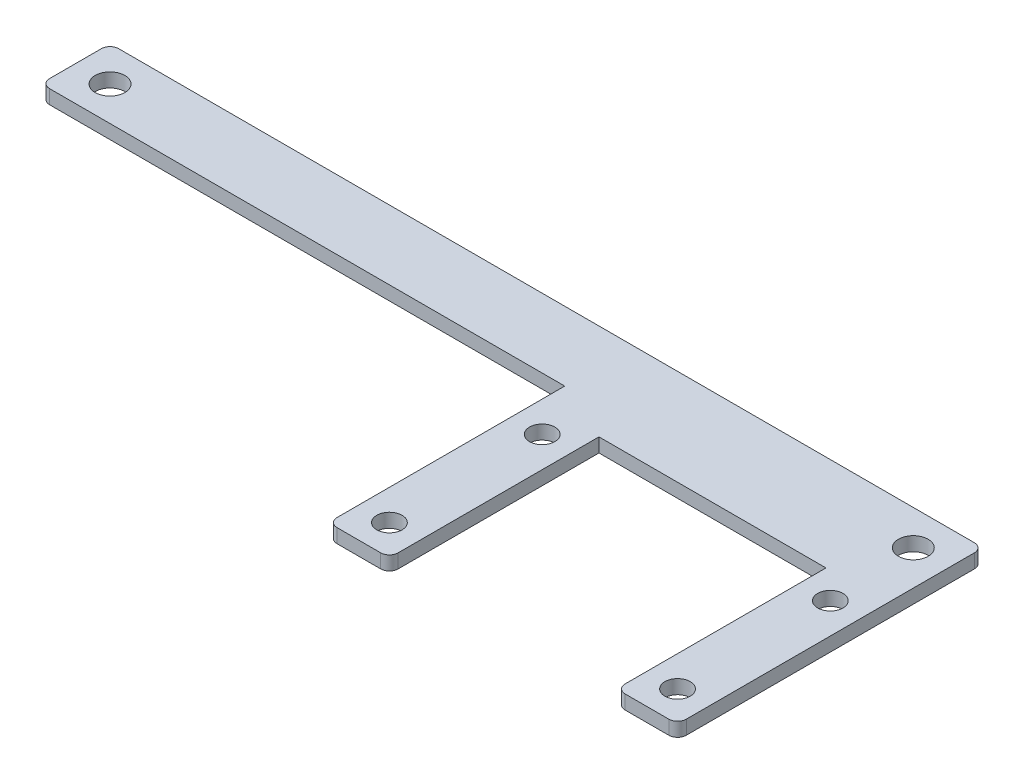
from build123d import *

# Parameters (mm, degrees)
SKETCH1_W           = 40
SKETCH1_H           = 35
BOSS_EXTRUDE1_DEPTH = 1.6
SKETCH2_R           = 1.45
SKETCH2_W           = 26
SKETCH2_H           = 24
CUT_EXTRUDE1_DEPTH  = 27.623485872
SKETCH4_W           = 60
SKETCH4_H           = 7.921096837
BOSS_EXTRUDE2_DEPTH = 1.6
SKETCH3_R           = 1.7
CUT_EXTRUDE2_DEPTH  = 82.90732568
FILLET1_R           = 1


with BuildPart() as part:
    # Sketch1 → Boss-Extrude1 (new body)
    with BuildSketch(Plane(origin=(0, 0, 0), x_dir=(1, 0, 0), z_dir=(0, 1, 0))):
        Rectangle(SKETCH1_W, SKETCH1_H)
    extrude(amount=BOSS_EXTRUDE1_DEPTH)

    # Sketch2 → Cut-Extrude1 (cut, through all)
    with BuildSketch(Plane(origin=(0, 1.6, 0), x_dir=(1, 0, 0), z_dir=(0, 1, 0))):
        with Locations(Location((-16.5, 3.5, 0), (0, 0, 270))):
            Circle(SKETCH2_R)
        with Locations(Location((-16.5, -14, 0), (0, 0, 270))):
            Circle(SKETCH2_R)
        with Locations(Location((16.5, 3.5, 0), (0, 0, 270))):
            Circle(SKETCH2_R)
        with Locations(Location((16.5, -14, 0), (0, 0, 270))):
            Circle(SKETCH2_R)
        with Locations((0, -5.5)):
            Rectangle(SKETCH2_W, SKETCH2_H)
    extrude(amount=-CUT_EXTRUDE1_DEPTH, mode=Mode.SUBTRACT)

    # Sketch4 → Boss-Extrude2 (add)
    with BuildSketch(Plane.XZ):
        with Locations((-50, -13.539451581)):
            Rectangle(SKETCH4_W, SKETCH4_H)
    extrude(amount=-BOSS_EXTRUDE2_DEPTH)

    # Sketch3 → Cut-Extrude2 (cut, through all)
    with BuildSketch(Plane(origin=(0, 1.6, 0), x_dir=(1, 0, 0), z_dir=(0, 1, 0))):
        with Locations(Location((16, 13.5, 0), (0, 0, 270))):
            Circle(SKETCH3_R)
        with Locations(Location((-76, 13.5, 0), (0, 0, 270))):
            Circle(SKETCH3_R)
    extrude(amount=-CUT_EXTRUDE2_DEPTH, mode=Mode.SUBTRACT)

    # Fillet1
    fillet1_edges = [part.edges().sort_by_distance(p)[0] for p in [
        (-13, 0.8, 17.5),
        (13, 0.8, 17.5),
        (-80, 0.8, -17.5),
        (-80, 0.8, -9.578903163),
        (20, 0.8, 17.5),
        (-20, 0.8, 17.5),
        (20, 0.8, -17.5),
    ]]
    fillet(fillet1_edges, radius=FILLET1_R)


solid = part.part
